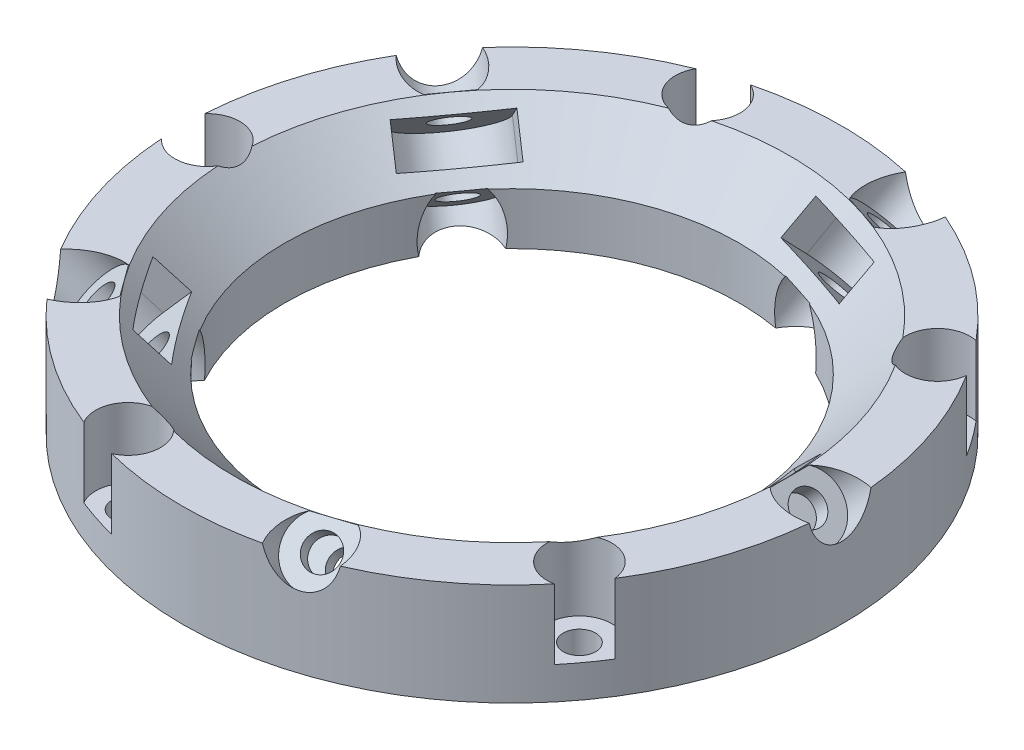
from build123d import *

# Parameters (mm, degrees)
CUT_EXTRUDE1_START = -5.5
SKETCH3_R          = 2.5
CUT_EXTRUDE1_DEPTH = 6
SKETCH3_2_R        = 2.5
CUT_EXTRUDE2_DEPTH = 99.935032429
CUT_EXTRUDE3_START = -2.5
SKETCH5_R          = 5
CUT_EXTRUDE3_DEPTH = 8
CUT_EXTRUDE4_START = 16.5
SKETCH5_2_R        = 5
CUT_EXTRUDE4_DEPTH = 8
CIRPATTERN1_COUNT  = 5
SKETCH6_R          = 2.5
CUT_EXTRUDE5_DEPTH = 30.2
CUT_EXTRUDE6_START = 12
SKETCH7_R          = 5
CUT_EXTRUDE6_DEPTH = 64.404034856
CIRPATTERN2_COUNT  = 5


with BuildPart() as part:
    # Sketch2 → Revolve1 (revolve)
    with BuildSketch(Plane.XY):
        Polygon((35.050252532, 6.997040879), (35.050252532, 14.997040879), (42.828427125, 22.775215472), (50.828427125, 22.775215472), (50.828427125, 6.997040879), align=None)
    revolve(axis=Axis((0, 55, 0), (0, -1, 0)))

    # Sketch3 → Cut-Extrude1 (cut)
    with BuildSketch(Plane(origin=(30.680500955, 30.680500955, 0), x_dir=(0.7071067811865489, -0.7071067811865461, 0), z_dir=(0.7071067811865461, 0.7071067811865489, 0)).offset(CUT_EXTRUDE1_START)):
        with BuildLine():
            Line((18.179761944, -7), (11.179761944, -7))
            Line((11.179761944, -7), (11.179761944, 7))
            Line((11.179761944, 7), (18.179761944, 7))
            ThreePointArc((18.179761944, 7), (25.179761944, 0), (18.179761944, -7))
        make_face()
        with Locations((18.179761944, 0)):
            Circle(SKETCH3_R, mode=Mode.SUBTRACT)
    cut_extrude1 = extrude(amount=CUT_EXTRUDE1_DEPTH, mode=Mode.SUBTRACT)

    # Sketch3<2> → Cut-Extrude2 (cut, symmetric)
    with BuildSketch(Plane(origin=(30.680500955, 30.680500955, 0), x_dir=(0.7071067811865489, -0.7071067811865461, 0), z_dir=(0.7071067811865461, 0.7071067811865489, 0))):
        with Locations((18.179761944, 0)):
            Circle(SKETCH3_2_R)
    cut_extrude2 = extrude(amount=CUT_EXTRUDE2_DEPTH, both=True, mode=Mode.SUBTRACT)

    # Sketch5 → Cut-Extrude3 (cut)
    with BuildSketch(Plane(origin=(26.791413658, 26.791413658, 0), x_dir=(0, 0, -1), z_dir=(0.7071067811865461, 0.7071067811865489, 0)).offset(CUT_EXTRUDE3_START)):
        with Locations((0, -18.179761944)):
            Circle(SKETCH5_R)
    cut_extrude3 = extrude(amount=-CUT_EXTRUDE3_DEPTH, mode=Mode.SUBTRACT)

    # Sketch5<2> → Cut-Extrude4 (cut)
    with BuildSketch(Plane(origin=(26.791413658, 26.791413658, 0), x_dir=(0, 0, -1), z_dir=(0.7071067811865461, 0.7071067811865489, 0)).offset(CUT_EXTRUDE4_START)):
        with Locations((0, -18.179761944)):
            Circle(SKETCH5_2_R)
    cut_extrude4 = extrude(amount=-CUT_EXTRUDE4_DEPTH, mode=Mode.SUBTRACT)

    # CirPattern1: Cut-Extrude1, Cut-Extrude2, Cut-Extrude3, Cut-Extrude4 ×5 about axis
    cirpattern1_axis = Axis((0, 55, 0), (0, -1, 0))
    add([cut_extrude1.rotate(cirpattern1_axis, i * 360 / CIRPATTERN1_COUNT) for i in range(1, CIRPATTERN1_COUNT)], mode=Mode.SUBTRACT)
    add([cut_extrude2.rotate(cirpattern1_axis, i * 360 / CIRPATTERN1_COUNT) for i in range(1, CIRPATTERN1_COUNT)], mode=Mode.SUBTRACT)
    add([cut_extrude3.rotate(cirpattern1_axis, i * 360 / CIRPATTERN1_COUNT) for i in range(1, CIRPATTERN1_COUNT)], mode=Mode.SUBTRACT)
    add([cut_extrude4.rotate(cirpattern1_axis, i * 360 / CIRPATTERN1_COUNT) for i in range(1, CIRPATTERN1_COUNT)], mode=Mode.SUBTRACT)

    # Sketch6 → Cut-Extrude5 (cut)
    with BuildSketch(Plane(origin=(0, 0, 0), x_dir=(1, 0, 0), z_dir=(0, 1, 0))):
        with Locations((-47, 0)):
            Circle(SKETCH6_R)
    cut_extrude5 = extrude(amount=CUT_EXTRUDE5_DEPTH, mode=Mode.SUBTRACT)

    # Sketch7 → Cut-Extrude6 (cut, through all)
    with BuildSketch(Plane(origin=(0, 0, 0), x_dir=(1, 0, 0), z_dir=(0, 1, 0)).offset(CUT_EXTRUDE6_START)):
        with Locations((-47, 0)):
            Circle(SKETCH7_R)
    cut_extrude6 = extrude(amount=CUT_EXTRUDE6_DEPTH, mode=Mode.SUBTRACT)

    # CirPattern2: Cut-Extrude5, Cut-Extrude6 ×5 about axis
    cirpattern2_axis = Axis((0, 55, 0), (0, -1, 0))
    add([cut_extrude5.rotate(cirpattern2_axis, i * 360 / CIRPATTERN2_COUNT) for i in range(1, CIRPATTERN2_COUNT)], mode=Mode.SUBTRACT)
    add([cut_extrude6.rotate(cirpattern2_axis, i * 360 / CIRPATTERN2_COUNT) for i in range(1, CIRPATTERN2_COUNT)], mode=Mode.SUBTRACT)


solid = part.part
